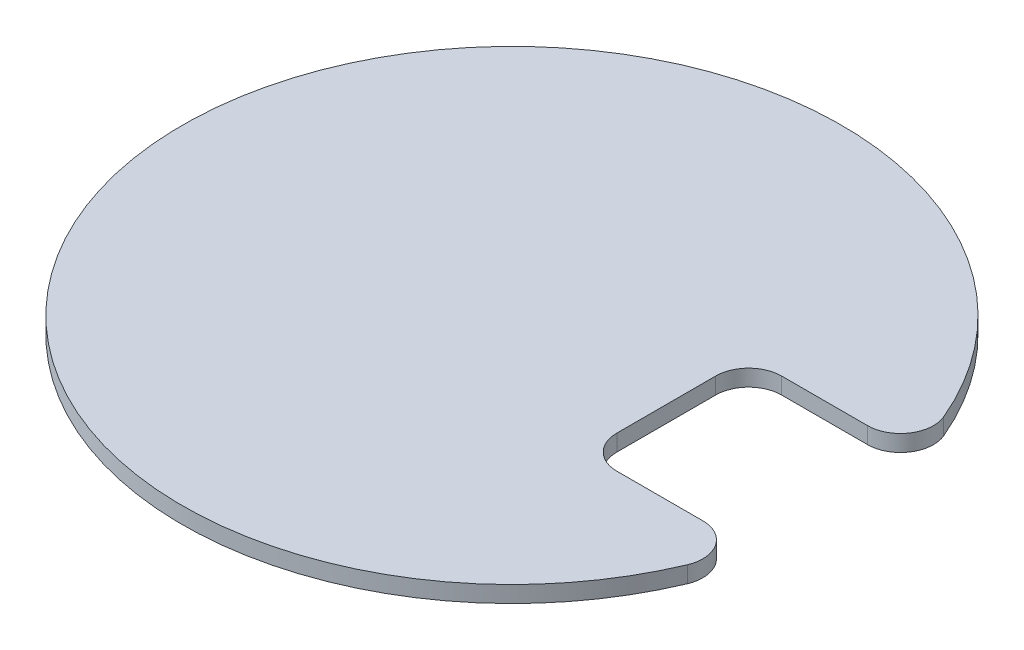
from build123d import *

# Parameters (mm, degrees)
BOSS_EXTRUDE1_DEPTH = 1


with BuildPart() as part:
    # Sketch1 → Boss-Extrude1 (new body)
    with BuildSketch(Plane(origin=(0, 0, 0), x_dir=(1, 0, 0), z_dir=(0, 1, 0))):
        with BuildLine():
            Line((16.583123952, 5), (11.364916731, 5))
            ThreePointArc((11.364916731, 5), (9.950703169, 4.414213562), (9.364916731, 3))
            Line((9.364916731, 3), (9.364916731, -3))
            ThreePointArc((9.364916731, -3), (9.950703169, -4.414213562), (11.364916731, -5))
            Line((11.364916731, -5), (16.583123952, -5))
            ThreePointArc((16.583123952, -5), (18.249790618, -5.894458403), (18.42569328, -7.777777778))
            ThreePointArc((18.42569328, -7.777777778), (-20, 0), (18.42569328, 7.777777778))
            ThreePointArc((18.42569328, 7.777777778), (18.249790618, 5.894458403), (16.583123952, 5))
        make_face()
    extrude(amount=BOSS_EXTRUDE1_DEPTH)


solid = part.part
